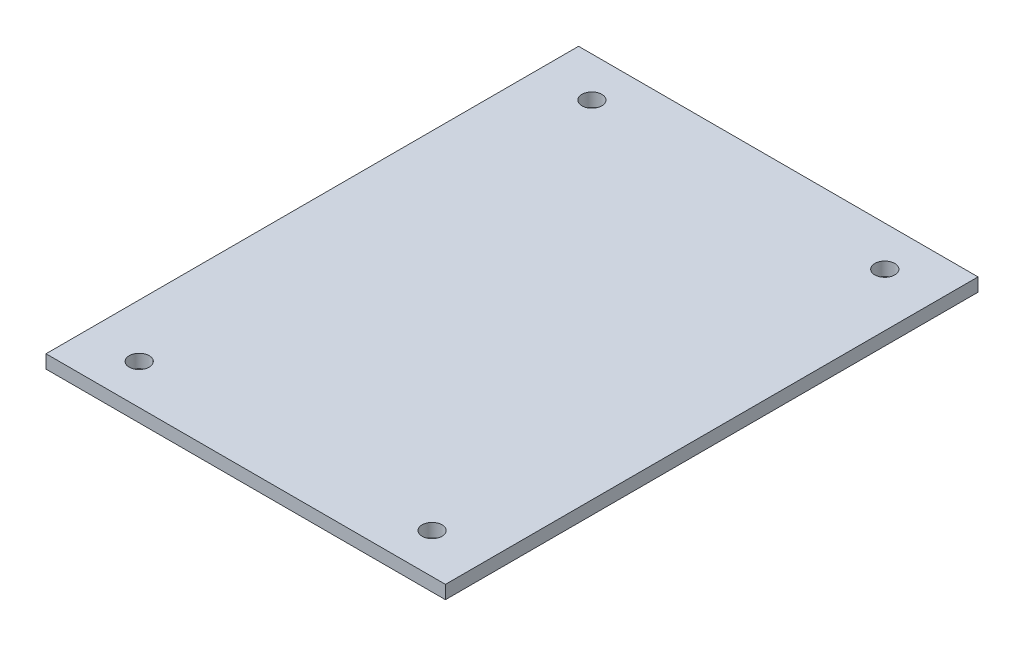
from build123d import *

# Parameters (mm, degrees)
SKETCH1_W           = 76.2
SKETCH1_H           = 101.6
BOSS_EXTRUDE1_DEPTH = 2.54
SKETCH2_R           = 1.905
CUT_EXTRUDE1_DEPTH  = 64.550779696


with BuildPart() as part:
    # Sketch1 → Boss-Extrude1 (new body)
    with BuildSketch(Plane(origin=(0, 0, 0), x_dir=(1, 0, 0), z_dir=(0, 1, 0))):
        Rectangle(SKETCH1_W, SKETCH1_H)
    extrude(amount=BOSS_EXTRUDE1_DEPTH)

    # Sketch2 → Cut-Extrude1 (cut, through all)
    with BuildSketch(Plane(origin=(0, 2.54, 0), x_dir=(1, 0, 0), z_dir=(0, 1, 0))):
        with Locations(Location((-27.94, 43.18, 0), (0, 0, 270))):
            Circle(SKETCH2_R)
        with Locations(Location((27.94, 43.18, 0), (0, 0, 270))):
            Circle(SKETCH2_R)
        with Locations(Location((-27.94, -43.18, 0), (0, 0, 270))):
            Circle(SKETCH2_R)
        with Locations(Location((27.94, -43.18, 0), (0, 0, 270))):
            Circle(SKETCH2_R)
    extrude(amount=-CUT_EXTRUDE1_DEPTH, mode=Mode.SUBTRACT)


solid = part.part
